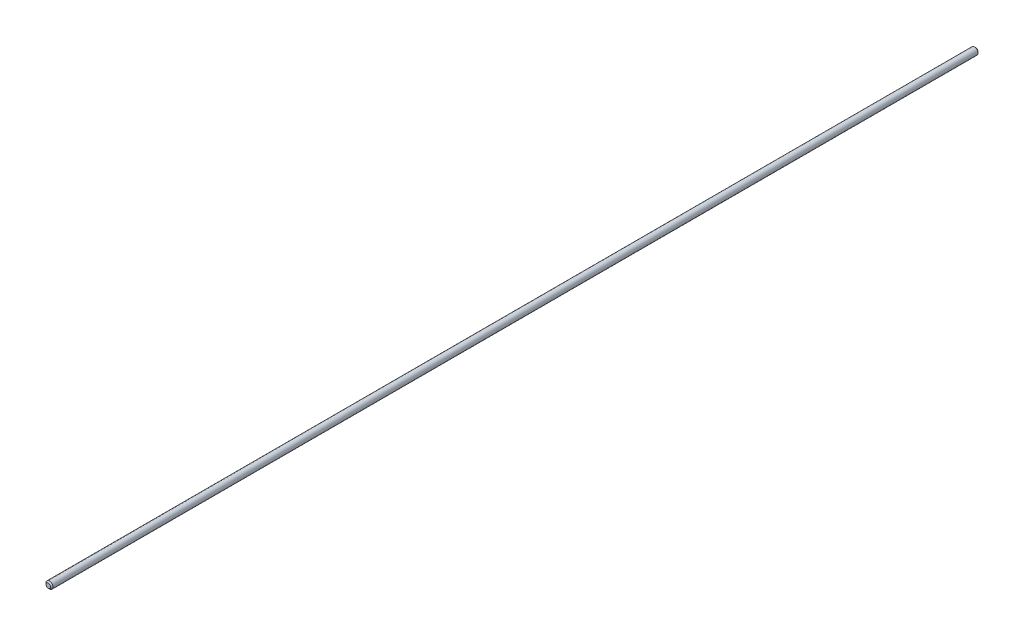
from build123d import *

# Parameters (mm, degrees)
IZIM1_R                     = 3
Y_KSEKLIK_EKSTR_ZYON1_DEPTH = 800
PAH1_SIZE                   = 1


with BuildPart() as part:
    # Çizim1 → Yükseklik-Ekstrüzyon1 (new body)
    with BuildSketch(Plane.XY):
        Circle(IZIM1_R)
    extrude(amount=Y_KSEKLIK_EKSTR_ZYON1_DEPTH)

    # Pah1
    pah1_edges = [part.edges().sort_by_distance(p)[0] for p in [
        (-3, 0, 0),
        (-3, 0, 800),
    ]]
    chamfer(pah1_edges, length=PAH1_SIZE)


solid = part.part
